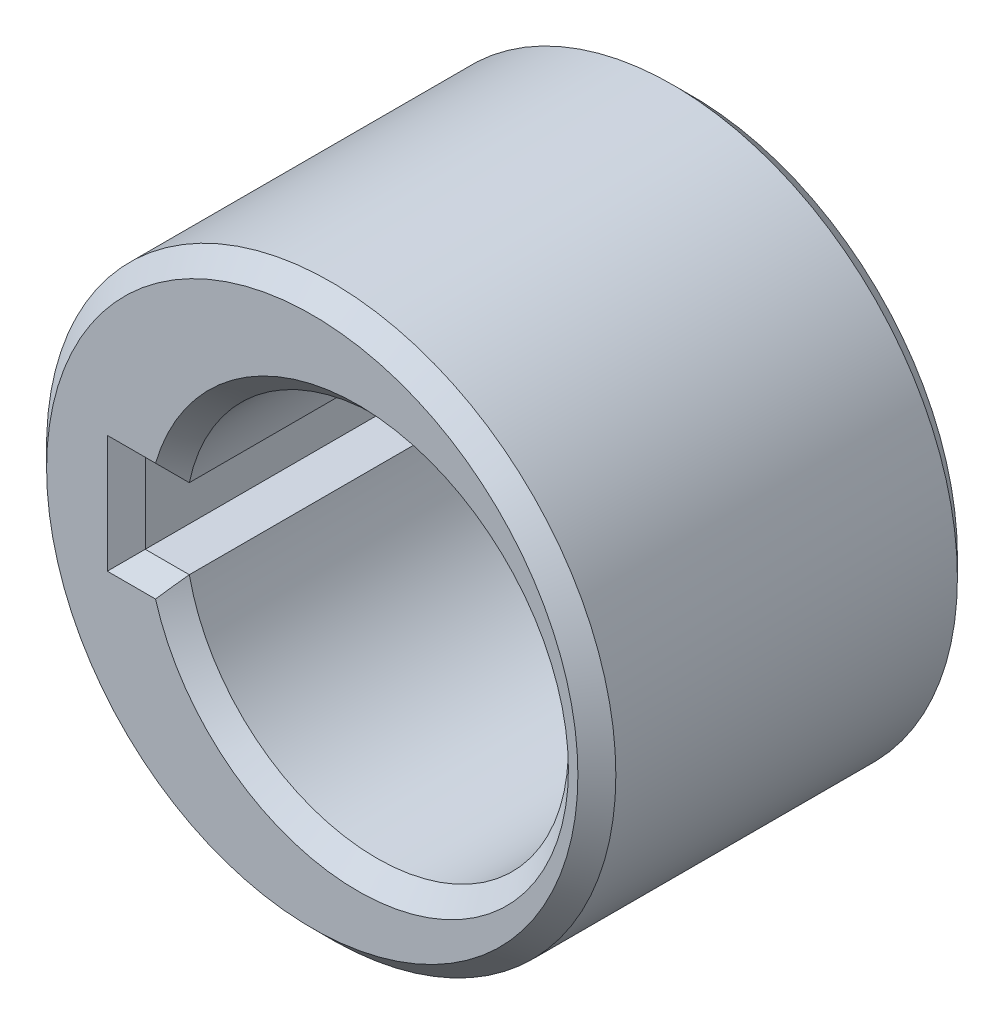
from build123d import *

# Parameters (mm, degrees)
SKETCH1_R           = 7.5
SKETCH1_R_2         = 5.05
BOSS_EXTRUDE1_DEPTH = 10
SKETCH2_W           = 6.1
SKETCH2_H           = 2.1
CUT_EXTRUDE1_DEPTH  = 16.229576488
CHAMFER1_SIZE       = 0.5
CHAMFER2_SIZE       = 0.5
CHAMFER3_SIZE       = 0.5


with BuildPart() as part:
    # Sketch1 → Boss-Extrude1 (new body)
    with BuildSketch(Plane.XY):
        with Locations((-1.2, 0)):
            Circle(SKETCH1_R)
        Circle(SKETCH1_R_2, mode=Mode.SUBTRACT)
    extrude(amount=BOSS_EXTRUDE1_DEPTH)

    # Sketch2 → Cut-Extrude1 (cut, through all)
    with BuildSketch(Plane.XY.offset(10)):
        with Locations((-3.05, 0)):
            Rectangle(SKETCH2_W, SKETCH2_H)
    extrude(amount=-CUT_EXTRUDE1_DEPTH, mode=Mode.SUBTRACT)

    # Chamfer1
    chamfer1_edges = [part.edges().sort_by_distance(p)[0] for p in [
        (-6.1, 0, 10),
        (-5.519817807, 1.05, 10),
        (-5.519817807, -1.05, 10),
        (5.05, 0, 10),
    ]]
    chamfer(chamfer1_edges, length=CHAMFER1_SIZE)

    # Chamfer2
    chamfer2_edges = [part.edges().sort_by_distance(p)[0] for p in [
        (5.05, 0, 0),
        (-5.519817807, -1.05, 0),
        (-5.519817807, 1.05, 0),
        (-6.1, 0, 0),
    ]]
    chamfer(chamfer2_edges, length=CHAMFER2_SIZE)

    # Chamfer3
    chamfer3_edges = [part.edges().sort_by_distance(p)[0] for p in [
        (-8.7, 0, 0),
        (-8.7, 0, 10),
    ]]
    chamfer(chamfer3_edges, length=CHAMFER3_SIZE)


solid = part.part
